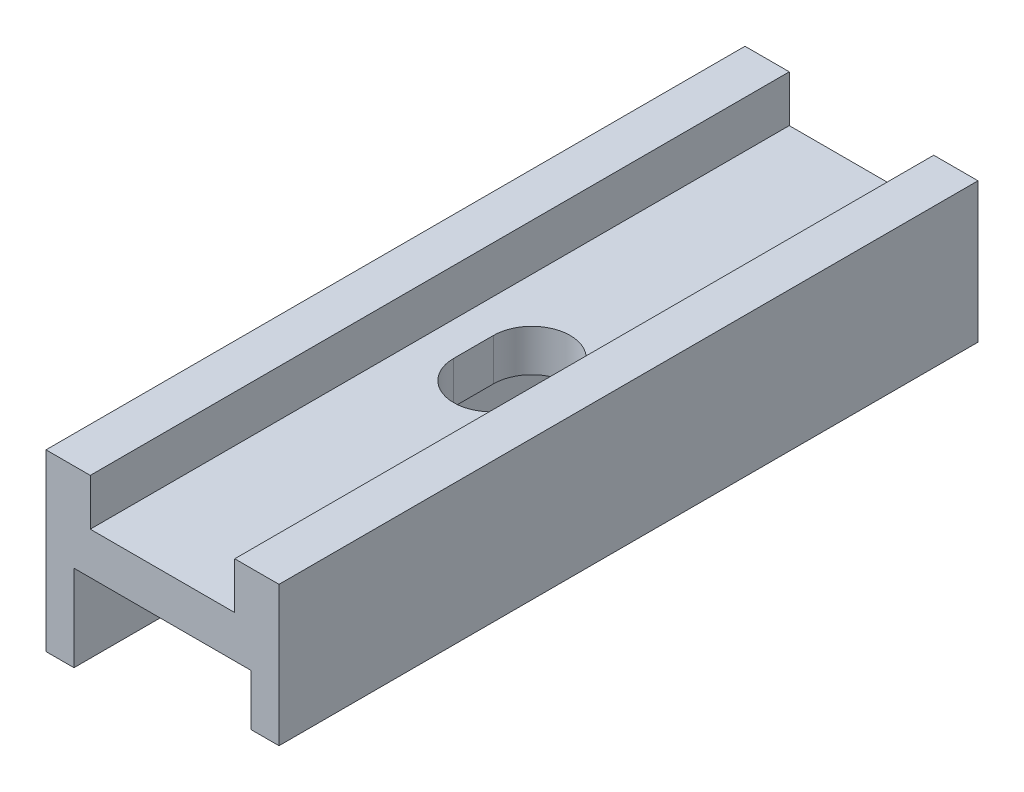
from build123d import *

# Parameters (mm, degrees)
BOSS_EXTRUDE1_DEPTH = 38.1
CUT_EXTRUDE1_REACH  = 44.521


with BuildPart() as part:
    # Sketch1 → Boss-Extrude1 (new, symmetric)
    with BuildSketch(Plane.XY):
        Polygon((-12.7, 7.62), (-7.874, 7.62), (-7.874, 2.54), (7.874, 2.54), (7.874, 7.62), (12.7, 7.62), (12.7, -7.62), (9.652, -7.62), (9.652, -2.032), (-9.652, -2.032), (-9.652, -11.43), (-12.7, -11.43), align=None)
    extrude(amount=BOSS_EXTRUDE1_DEPTH, both=True)

    # Sketch2 → Cut-Extrude1 (cut, up to next)
    with BuildSketch(Plane(origin=(0, 2.54, 0), x_dir=(1, 0, 0), z_dir=(0, 1, 0)), mode=Mode.PRIVATE) as cut_extrude1_sk1:
        with BuildLine():
            Line((4.191, 2.159), (4.191, -2.159))
            ThreePointArc((4.191, -2.159), (0, -6.35), (-4.191, -2.159))
            Line((-4.191, -2.159), (-4.191, 2.159))
            ThreePointArc((-4.191, 2.159), (0, 6.35), (4.191, 2.159))
        make_face()
    cut_extrude1_tool1 = extrude(cut_extrude1_sk1.sketch, amount=-CUT_EXTRUDE1_REACH, mode=Mode.PRIVATE) & part.part
    add(cut_extrude1_tool1.solids().sort_by_distance((0, 2.54, 0))[0], mode=Mode.SUBTRACT)


solid = part.part
